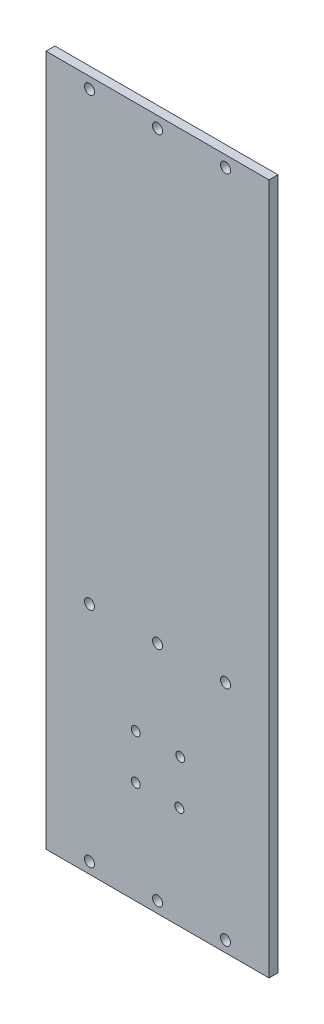
from build123d import *

# Parameters (mm, degrees)
SCHIZZO1_W                   = 100
SCHIZZO1_H                   = 310
SCHIZZO1_R                   = 2.25
SCHIZZO1_R_2                 = 2
ESTRUSIONE_ESTRUSIONE1_DEPTH = 4


with BuildPart() as part:
    # Schizzo1 → Estrusione-Estrusione1 (new body)
    with BuildSketch(Plane.XY):
        with Locations((50, 155)):
            Rectangle(SCHIZZO1_W, SCHIZZO1_H)
        with Locations((80.5, 5)):
            Circle(SCHIZZO1_R, mode=Mode.SUBTRACT)
        with Locations((50, 5)):
            Circle(SCHIZZO1_R, mode=Mode.SUBTRACT)
        with Locations(Location((19.5, 5, 0), (0, 0, 180))):
            Circle(SCHIZZO1_R, mode=Mode.SUBTRACT)
        with Locations((19.5, 305)):
            Circle(SCHIZZO1_R, mode=Mode.SUBTRACT)
        with Locations(Location((50, 305, 0), (0, 0, 180))):
            Circle(SCHIZZO1_R, mode=Mode.SUBTRACT)
        with Locations(Location((80.5, 305, 0), (0, 0, 180))):
            Circle(SCHIZZO1_R, mode=Mode.SUBTRACT)
        with Locations((40.207634416, 46)):
            Circle(SCHIZZO1_R_2, mode=Mode.SUBTRACT)
        with Locations(Location((59.792365584, 46, 0), (0, 0, 180))):
            Circle(SCHIZZO1_R_2, mode=Mode.SUBTRACT)
        with Locations((40.207634416, 66)):
            Circle(SCHIZZO1_R_2, mode=Mode.SUBTRACT)
        with Locations((60.207634416, 66)):
            Circle(SCHIZZO1_R_2, mode=Mode.SUBTRACT)
        with Locations((50, 105)):
            Circle(SCHIZZO1_R, mode=Mode.SUBTRACT)
        with Locations(Location((80.5, 105, 0), (0, 0, 180))):
            Circle(SCHIZZO1_R, mode=Mode.SUBTRACT)
        with Locations((19.5, 105)):
            Circle(SCHIZZO1_R, mode=Mode.SUBTRACT)
    extrude(amount=-ESTRUSIONE_ESTRUSIONE1_DEPTH)


solid = part.part
